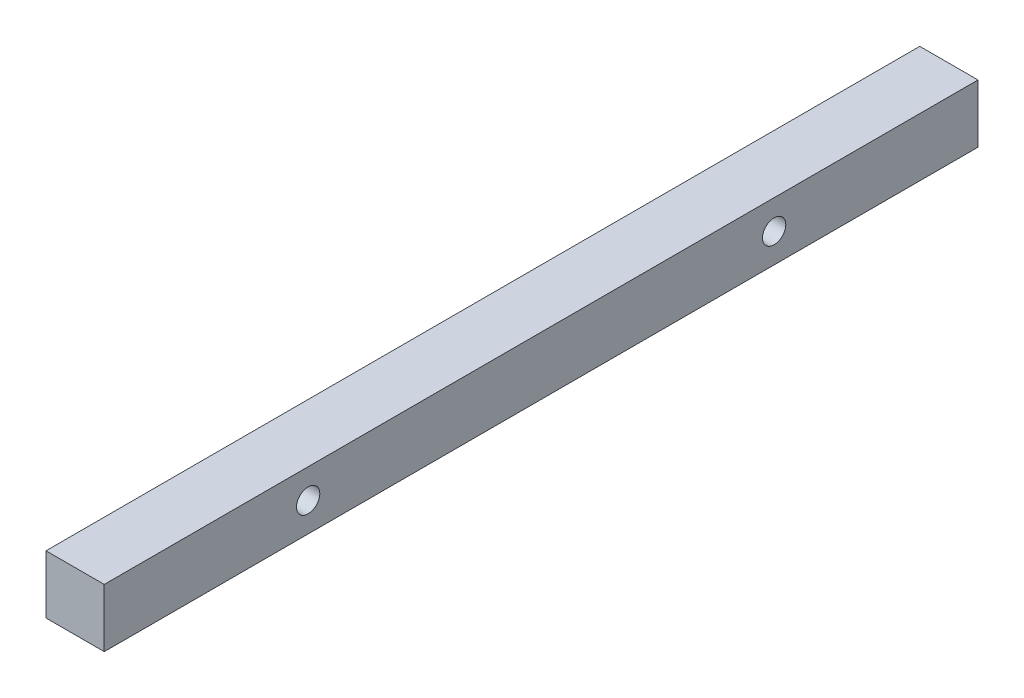
from build123d import *

# Parameters (mm, degrees)
CROQUIS1_W              = 20
CROQUIS1_H              = 20
SALIENTE_EXTRUIR1_DEPTH = 150
CROQUIS2_R              = 2.5
CORTAR_EXTRUIR1_DEPTH   = 151.665191733
CROQUIS3_R              = 4
CORTAR_EXTRUIR2_DEPTH   = 152.657508881


with BuildPart() as part:
    # Croquis1 → Saliente-Extruir1 (new, symmetric)
    with BuildSketch(Plane.XY):
        Rectangle(CROQUIS1_W, CROQUIS1_H)
    extrude(amount=SALIENTE_EXTRUIR1_DEPTH, both=True)

    # Croquis2 → Cortar-Extruir1 (cut, through all)
    with BuildSketch(Plane(origin=(0, 0, 0), x_dir=(0, 0, -1), z_dir=(1, 0, 0))):
        Circle(CROQUIS2_R)
        with Locations((140, 0)):
            Circle(CROQUIS2_R)
        with Locations(Location((-140, 0, 0), (0, 0, 180))):
            Circle(CROQUIS2_R)
    extrude(amount=-CORTAR_EXTRUIR1_DEPTH, mode=Mode.SUBTRACT)

    # Croquis3 → Cortar-Extruir2 (cut, through all)
    with BuildSketch(Plane.ZY.offset(10)):
        with Locations((80, 0)):
            Circle(CROQUIS3_R)
        with Locations(Location((-80, 0, 0), (0, 0, 180))):
            Circle(CROQUIS3_R)
    extrude(amount=-CORTAR_EXTRUIR2_DEPTH, mode=Mode.SUBTRACT)


solid = part.part
